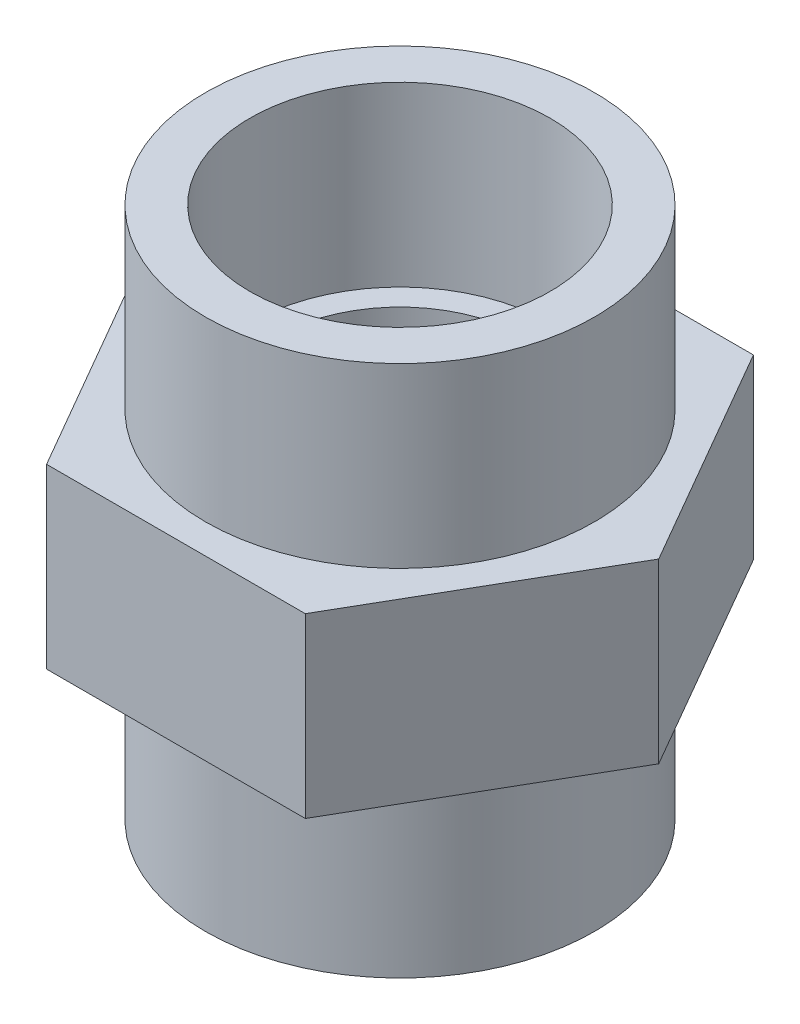
from build123d import *

# Parameters (mm, degrees)
SKETCH_1_R      = 6.579
SKETCH_1_R_2    = 4.25
EXTRUDE_1_DEPTH = 6
EXTRUDE_START   = 6
SKETCH_1_3_R    = 4.25
EXTRUDE_2_DEPTH = 6
SKETCH_2_R      = 6.579
SKETCH_2_R_2    = 5.079
EXTRUDE_3_DEPTH = 6


with BuildPart() as part:
    # 草图1 → 凸台-拉伸1 (new body)
    with BuildSketch(Plane(origin=(0, 0, 0), x_dir=(1, 0, 0), z_dir=(0, 1, 0))):
        Circle(SKETCH_1_R)
        Circle(SKETCH_1_R_2, mode=Mode.SUBTRACT)
    extrude(amount=-EXTRUDE_1_DEPTH)

    # 草图1<3> → 凸台-拉伸2 (add)
    with BuildSketch(Plane(origin=(0, 0, 0), x_dir=(1, 0, 0), z_dir=(0, 1, 0)).offset(EXTRUDE_START)):
        Polygon((-4.37573769, -7.579), (4.37573769, -7.579), (8.75147538, 0), (4.37573769, 7.579), (-4.37573769, 7.579), (-8.75147538, 0), align=None)
        Circle(SKETCH_1_3_R, mode=Mode.SUBTRACT)
    extrude(amount=-EXTRUDE_2_DEPTH)

    # 草图2 → 凸台-拉伸3 (add)
    with BuildSketch(Plane(origin=(0, 6, 0), x_dir=(1, 0, 0), z_dir=(0, 1, 0)).offset(EXTRUDE_START)):
        Circle(SKETCH_2_R)
        Circle(SKETCH_2_R_2, mode=Mode.SUBTRACT)
    extrude(amount=-EXTRUDE_3_DEPTH)


solid = part.part
